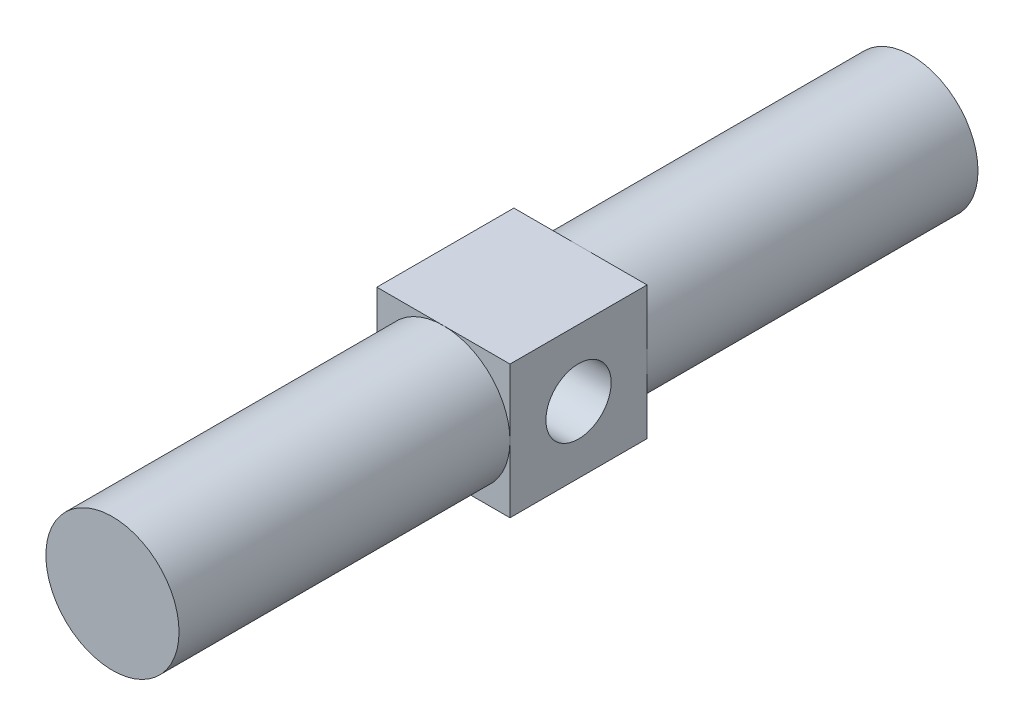
from build123d import *

# Parameters (mm, degrees)
SKETCH1_R                = 6.35
BOSS_EXTRUDE1_DEPTH      = 76.2
BOSS_EXTRUDE2_DEPTH      = 6.35
BOSS_EXTRUDE2_DEPTH_BACK = 6.35
SKETCH2_W                = 13.071299085
SKETCH2_H                = 12.7
CUT_EXTRUDE1_DEPTH       = 6.35
CUT_EXTRUDE1_DEPTH_BACK  = 6.35
SKETCH3_R                = 3.1115


with BuildPart() as part:
    # Sketch1 → Boss-Extrude1 (new body)
    with BuildSketch(Plane.XY):
        Circle(SKETCH1_R)
    extrude(amount=BOSS_EXTRUDE1_DEPTH)

    # Sketch2 → Boss-Extrude2 (add, two sides: drawn at the far end of the back side and taken through both)
    with BuildSketch(Plane(origin=(0, 0, 0), x_dir=(0, 0, -1), z_dir=(1, 0, 0)).offset(-BOSS_EXTRUDE2_DEPTH_BACK)):
        with Locations((-38.10000004, 0)):
            Rectangle(SKETCH2_W, SKETCH2_H)
    extrude(amount=BOSS_EXTRUDE2_DEPTH + BOSS_EXTRUDE2_DEPTH_BACK)

    # Sketch3 → Cut-Extrude1 (cut, two sides: drawn at the far end of the back side and taken through both)
    with BuildSketch(Plane(origin=(0, 0, 0), x_dir=(0, 0, -1), z_dir=(1, 0, 0)).offset(-CUT_EXTRUDE1_DEPTH_BACK)):
        with Locations((-38.1, 0)):
            Circle(SKETCH3_R)
    extrude(amount=CUT_EXTRUDE1_DEPTH + CUT_EXTRUDE1_DEPTH_BACK, mode=Mode.SUBTRACT)


solid = part.part
